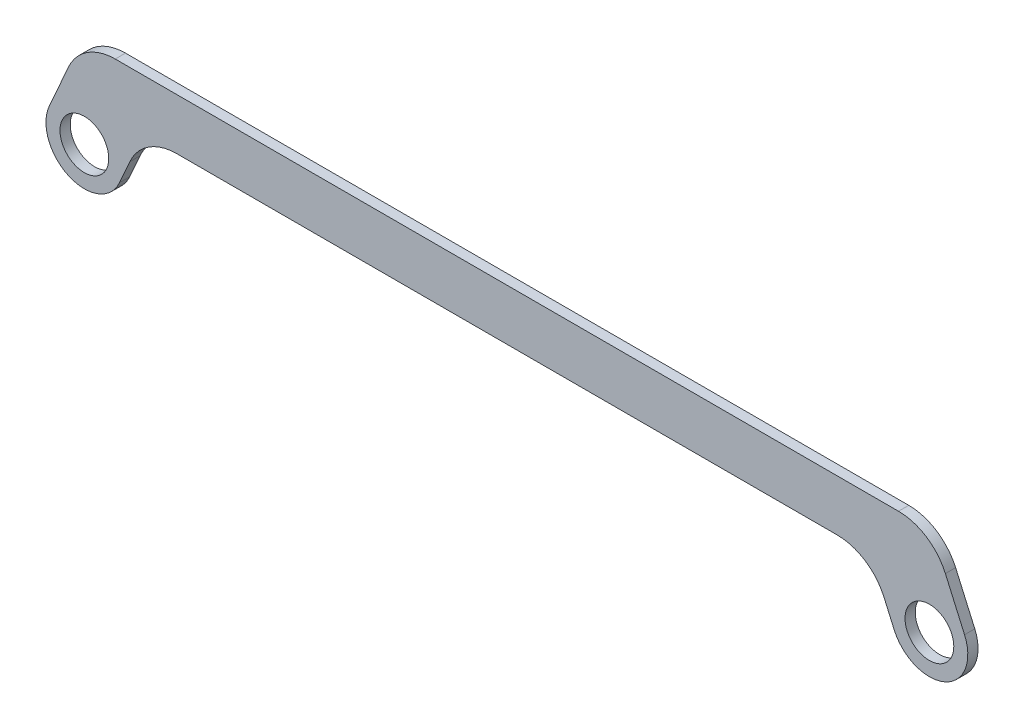
from build123d import *

# Parameters (mm, degrees)
SKETCH_1_R      = 9.525
EXTRUDE_1_DEPTH = 4
FILLET_1_R      = 20


with BuildPart() as part:
    # 草图1 → 凸台-拉伸1 (new body)
    with BuildSketch(Plane.XY):
        with BuildLine():
            Line((-0.980060917, 34.935304473), (330.980060917, 34.935304473))
            Line((330.980060917, 34.935304473), (343.723377386, 6.055486201))
            ThreePointArc((343.723377386, 6.055486201), (336.055486201, -13.723377386), (316.276622614, -6.055486201))
            Line((316.276622614, -6.055486201), (307.014365977, 14.935304473))
            Line((307.014365977, 14.935304473), (22.985634023, 14.935304473))
            Line((22.985634023, 14.935304473), (13.723377386, -6.055486201))
            ThreePointArc((13.723377386, -6.055486201), (-6.055486201, -13.723377386), (-13.723377386, 6.055486201))
            Line((-13.723377386, 6.055486201), (-0.980060917, 34.935304473))
        make_face()
        Circle(SKETCH_1_R, mode=Mode.SUBTRACT)
        with Locations((330, 0)):
            Circle(SKETCH_1_R, mode=Mode.SUBTRACT)
    extrude(amount=EXTRUDE_1_DEPTH)

    # 圆角1
    fillet_1_edges = [part.edges().sort_by_distance(p)[0] for p in [
        (-0.980060917, 34.935304473, 2),
        (330.980060917, 34.935304473, 2),
        (307.014365977, 14.935304473, 2),
        (22.985634023, 14.935304473, 2),
    ]]
    fillet(fillet_1_edges, radius=FILLET_1_R)


solid = part.part
